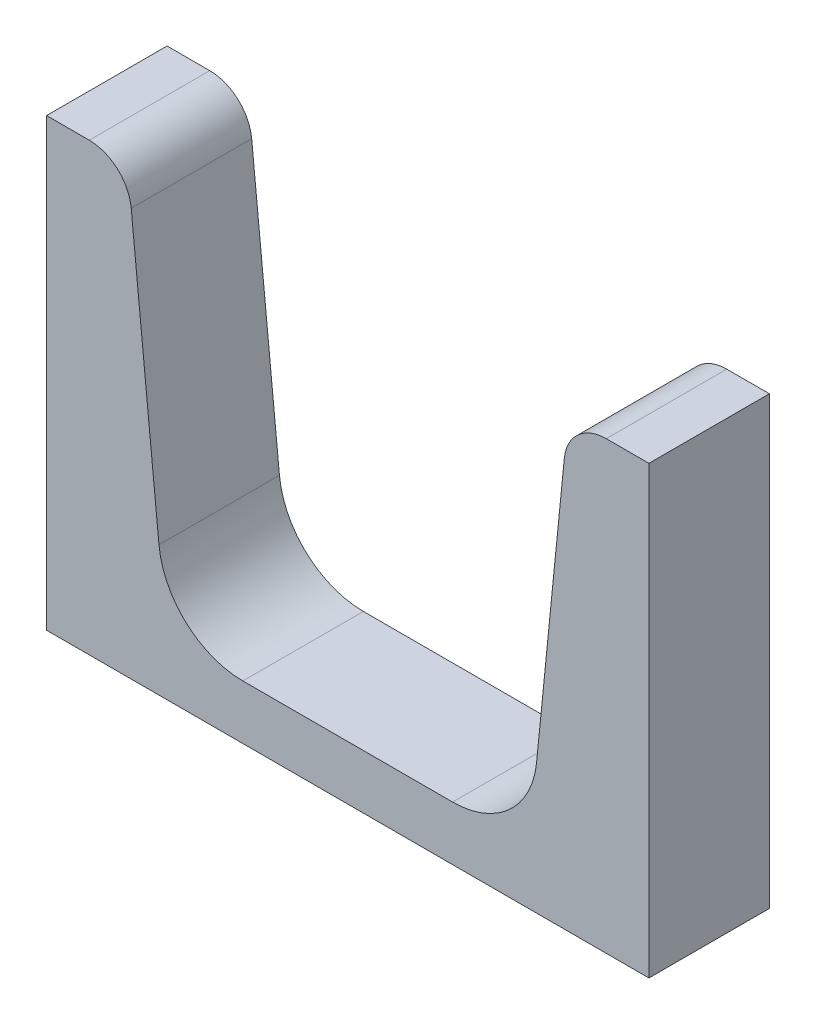
from build123d import *

# Parameters (mm, degrees)
EXTRUDE_1_DEPTH = 10
FILLET_1_R      = 3.5
FILLET_2_R      = 7


with BuildPart() as part:
    # 草图1 → 凸台-拉伸1 (new body)
    with BuildSketch(Plane(origin=(0, 0, 0), x_dir=(-1, 0, 0), z_dir=(0, 0, -1))):
        Polygon((25, 0), (-25, 0), (-25, 37), (-18.290755601, 37), (-15.040755601, 4.5), (15.040755601, 4.5), (18.290755601, 37), (25, 37), align=None)
    extrude(amount=-EXTRUDE_1_DEPTH)

    # 圆角1
    fillet_1_edges = [part.edges().sort_by_distance(p)[0] for p in [
        (-18.290755601, 37, 5),
        (18.290755601, 37, 5),
    ]]
    fillet(fillet_1_edges, radius=FILLET_1_R)

    # 圆角2
    fillet_2_edges = [part.edges().sort_by_distance(p)[0] for p in [
        (-15.040755601, 4.5, 5),
        (15.040755601, 4.5, 5),
    ]]
    fillet(fillet_2_edges, radius=FILLET_2_R)


solid = part.part
